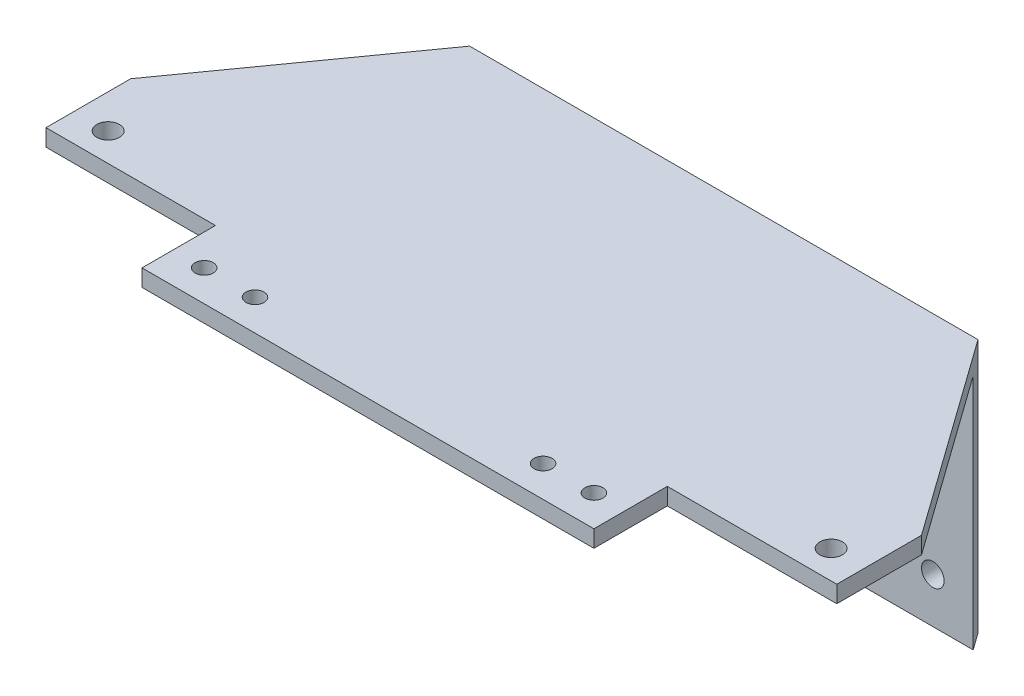
from build123d import *

# Parameters (mm, degrees)
EXTRUDE_1_DEPTH     = 140
CUT_EXTRUDE_1_REACH = 152.354
SKETCH_2_R          = 2
CUT_EXTRUDE_2_REACH = 151.164
SKETCH_3_R          = 2
CUT_EXTRUDE_3_DEPTH = 150.164338902
RIB_2_REACH         = 79.661
SKETCH_9_WALL_W     = 196.169186172
SKETCH_9_WALL_H     = 10
SKETCH_10_W         = 80
SKETCH_10_H         = 3
EXTRUDE_2_DEPTH     = 13
SKETCH_11_R         = 1.6
CUT_EXTRUDE_4_DEPTH = 3


with BuildPart() as part:
    # 草图1 → 凸台-拉伸1 (new body)
    with BuildSketch(Plane(origin=(0, 0, 0), x_dir=(0, 0, -1), z_dir=(1, 0, 0))):
        Polygon((22, 19.5), (22, -22.5), (25, -22.5), (25, 22.5), (-25, 22.5), (-25, 19.5), align=None)
    extrude(amount=EXTRUDE_1_DEPTH)

    # 草图2 → 切除-拉伸1 (cut, up to next)
    with BuildSketch(Plane(origin=(0, 0, -25), x_dir=(-1, 0, 0), z_dir=(0, 0, -1)), mode=Mode.PRIVATE) as cut_extrude_1_sk1:
        with Locations((-110, -14.5)):
            Circle(SKETCH_2_R)
    cut_extrude_1_tool1 = extrude(cut_extrude_1_sk1.sketch, amount=-CUT_EXTRUDE_1_REACH, mode=Mode.PRIVATE) & part.part
    # 草图2 → 切除-拉伸1 (cut, up to next)
    with BuildSketch(Plane(origin=(0, 0, -25), x_dir=(-1, 0, 0), z_dir=(0, 0, -1)), mode=Mode.PRIVATE) as cut_extrude_1_sk2:
        with Locations((-30, -14.5)):
            Circle(SKETCH_2_R)
    cut_extrude_1_tool2 = extrude(cut_extrude_1_sk2.sketch, amount=-CUT_EXTRUDE_1_REACH, mode=Mode.PRIVATE) & part.part
    add(cut_extrude_1_tool1.solids().sort_by_distance((110, -14.5, -25))[0], mode=Mode.SUBTRACT)
    add(cut_extrude_1_tool2.solids().sort_by_distance((30, -14.5, -25))[0], mode=Mode.SUBTRACT)

    # 草图3 → 切除-拉伸2 (cut, up to next)
    with BuildSketch(Plane(origin=(0, 22.5, 0), x_dir=(1, 0, 0), z_dir=(0, 1, 0)), mode=Mode.PRIVATE) as cut_extrude_2_sk1:
        with Locations(Location((6, -20, 0), (0, 0, 270))):
            Circle(SKETCH_3_R)
    cut_extrude_2_tool1 = extrude(cut_extrude_2_sk1.sketch, amount=-CUT_EXTRUDE_2_REACH, mode=Mode.PRIVATE) & part.part
    # 草图3 → 切除-拉伸2 (cut, up to next)
    with BuildSketch(Plane(origin=(0, 22.5, 0), x_dir=(1, 0, 0), z_dir=(0, 1, 0)), mode=Mode.PRIVATE) as cut_extrude_2_sk2:
        with Locations(Location((134, -20, 0), (0, 0, 270))):
            Circle(SKETCH_3_R)
    cut_extrude_2_tool2 = extrude(cut_extrude_2_sk2.sketch, amount=-CUT_EXTRUDE_2_REACH, mode=Mode.PRIVATE) & part.part
    add(cut_extrude_2_tool1.solids().sort_by_distance((6, 22.5, 20))[0], mode=Mode.SUBTRACT)
    add(cut_extrude_2_tool2.solids().sort_by_distance((134, 22.5, 20))[0], mode=Mode.SUBTRACT)

    # 草图4 → 切除-拉伸3 (cut, through all)
    with BuildSketch(Plane(origin=(0, 22.5, 0), x_dir=(1, 0, 0), z_dir=(0, 1, 0))):
        Polygon((140, 25), (115, 25), (140, -10), align=None)
        Polygon((25, 25), (0, 25), (0, -10), align=None)
    extrude(amount=-CUT_EXTRUDE_3_DEPTH, mode=Mode.SUBTRACT)

    # 草图9 wall → 筋2 (add, up to next)
    with BuildSketch(Plane(origin=(70, 7.303048218, -6.883599508), x_dir=(0, 0.627949157595, 0.778254364251), z_dir=(0, 0.778254364251, -0.627949157595)), mode=Mode.PRIVATE) as rib_2_sk1:
        Rectangle(SKETCH_9_WALL_W, SKETCH_9_WALL_H)
    rib_2_tool1 = extrude(rib_2_sk1.sketch, amount=RIB_2_REACH, mode=Mode.PRIVATE) - part.part
    add(rib_2_tool1.solids().sort_by_distance((70, 7.303048218, -6.883599508))[0])

    # 草图10 → 凸台-拉伸2 (add)
    with BuildSketch(Plane.XY.offset(25)):
        with Locations((70, 21)):
            Rectangle(SKETCH_10_W, SKETCH_10_H)
    extrude(amount=EXTRUDE_2_DEPTH)

    # 草图11 → 切除-拉伸4 (cut)
    with BuildSketch(Plane(origin=(0, 22.5, 0), x_dir=(1, 0, 0), z_dir=(0, 1, 0))):
        with Locations(Location((35.5, -32.5, 0), (0, 0, 270))):
            Circle(SKETCH_11_R)
        with Locations(Location((44.5, -32.5, 0), (0, 0, 270))):
            Circle(SKETCH_11_R)
        with Locations(Location((95.5, -32.5, 0), (0, 0, 270))):
            Circle(SKETCH_11_R)
        with Locations(Location((104.5, -32.5, 0), (0, 0, 270))):
            Circle(SKETCH_11_R)
    extrude(amount=-CUT_EXTRUDE_4_DEPTH, mode=Mode.SUBTRACT)


solid = part.part
